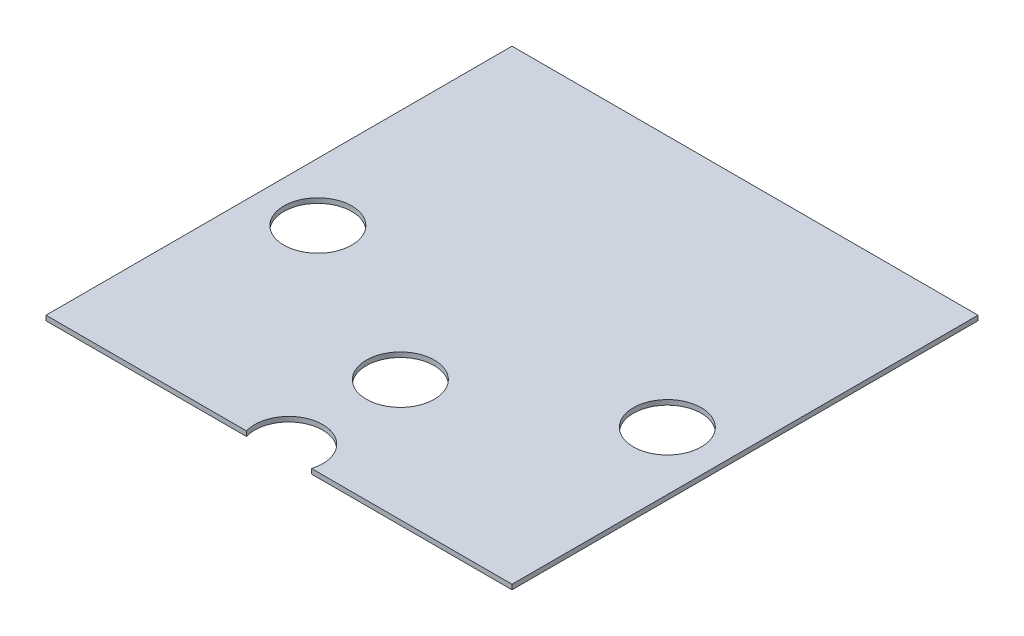
from build123d import *

# Parameters (mm, degrees)
SKETCH1_W           = 609.6
SKETCH1_H           = 609.6
BOSS_EXTRUDE1_DEPTH = 6.35
SKETCH2_R           = 44.45
CUT_EXTRUDE1_DEPTH  = 101.6


with BuildPart() as part:
    # Sketch1 → Boss-Extrude1 (new body)
    with BuildSketch(Plane(origin=(0, 0, 0), x_dir=(1, 0, 0), z_dir=(0, 1, 0))):
        with Locations((-82.357575758, -23.090909091)):
            Rectangle(SKETCH1_W, SKETCH1_H)
    extrude(amount=BOSS_EXTRUDE1_DEPTH)

    # Sketch2 → Cut-Extrude1 (cut)
    with BuildSketch(Plane(origin=(0, 6.35, 0), x_dir=(1, 0, 0), z_dir=(0, 1, 0))):
        with Locations(Location((-82.357575758, -169.140909091, 0), (0, 0, 270))):
            Circle(SKETCH2_R)
        with Locations((-82.357575758, -315.190909091)):
            Circle(SKETCH2_R)
        with Locations(Location((-310.957575758, -48.490909091, 0), (0, 0, 270))):
            Circle(SKETCH2_R)
        with Locations(Location((146.242424242, -48.490909091, 0), (0, 0, 270))):
            Circle(SKETCH2_R)
    extrude(amount=-CUT_EXTRUDE1_DEPTH, mode=Mode.SUBTRACT)


solid = part.part
